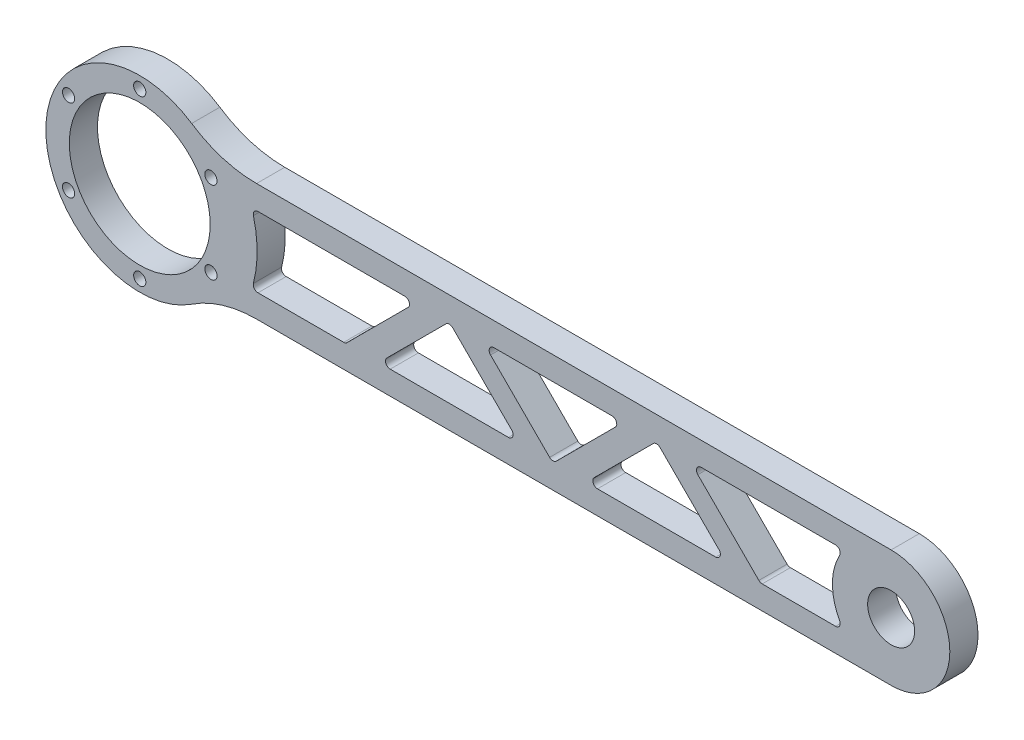
from build123d import *

# Parameters (mm, degrees)
EXTRUDE_1_DEPTH         = 12
SKETCH_5_R              = 30
SKETCH_5_R_2            = 10
CUT_EXTRUDE_1_DEPTH     = 348.51834484
CUT_EXTRUDE_3_DEPTH     = 348.51834484
FILLET_1_R              = 2
HOLE_WIZARD_5_2_5_2_1_D = 5.2


with BuildPart() as part:
    # 草图1 → 凸台-拉伸1 (new body)
    with BuildSketch(Plane.XY):
        with BuildLine():
            Line((320, 25), (49.749371855, 25))
            ThreePointArc((49.749371855, 25), (35.315615126, 27.128644612), (22.110831936, 33.333333333))
            ThreePointArc((22.110831936, 33.333333333), (-40, 0), (22.110831936, -33.333333333))
            ThreePointArc((22.110831936, -33.333333333), (35.315615126, -27.128644612), (49.749371855, -25))
            Line((49.749371855, -25), (320, -25))
            ThreePointArc((320, -25), (345, 0), (320, 25))
        make_face()
    extrude(amount=EXTRUDE_1_DEPTH)

    # 草图5 → 切除-拉伸1 (cut, through all)
    with BuildSketch(Plane.XY.offset(12)):
        Circle(SKETCH_5_R)
        with Locations((320, 0)):
            Circle(SKETCH_5_R_2)
    extrude(amount=-CUT_EXTRUDE_1_DEPTH, mode=Mode.SUBTRACT)

    # 草图6 → 切除-拉伸3 (cut, through all)
    with BuildSketch(Plane.XY.offset(12)):
        with BuildLine():
            Line((47.696960071, 15), (117.696960071, 15))
            Line((117.696960071, 15), (87.696960071, -15))
            Line((87.696960071, -15), (47.696960071, -15))
            ThreePointArc((47.696960071, -15), (50, 0), (47.696960071, 15))
        make_face()
        Polygon((131.839095695, 15), (101.839095695, -15), (161.839095695, -15), align=None)
        Polygon((145.981231318, 15), (175.981231318, -15), (205.981231318, 15), align=None)
        Polygon((220.123366942, 15), (190.123366942, -15), (250.123366942, -15), align=None)
        with BuildLine():
            Line((234.265502566, 15), (264.265502566, -15))
            Line((264.265502566, -15), (300, -15))
            ThreePointArc((300, -15), (295, 0), (300, 15))
            Line((300, 15), (234.265502566, 15))
        make_face()
    extrude(amount=-CUT_EXTRUDE_3_DEPTH, mode=Mode.SUBTRACT)

    # 圆角1
    fillet_1_edges = [part.edges().sort_by_distance(p)[0] for p in [
        (117.696960071, 15, 6),
        (87.696960071, -15, 6),
        (47.696960071, -15, 6),
        (47.696960071, 15, 6),
        (145.981231318, 15, 6),
        (205.981231318, 15, 6),
        (175.981231318, -15, 6),
        (300, 15, 6),
        (300, -15, 6),
        (264.265502566, -15, 6),
        (234.265502566, 15, 6),
        (220.123366942, 15, 6),
        (250.123366942, -15, 6),
        (190.123366942, -15, 6),
        (131.839095695, 15, 6),
        (161.839095695, -15, 6),
        (101.839095695, -15, 6),
    ]]
    fillet(fillet_1_edges, radius=FILLET_1_R)

    # Ø5.2 (5.2) 直径孔1 (through all)
    with Locations(Plane(origin=(0, 35, 12), x_dir=(1, 0, 0), z_dir=(0, 0, 1))):
        with Locations((0, 0), (-30.310889132, -17.5), (-30.310889132, -52.5), (0, -70), (30.310889132, -52.5), (30.310889132, -17.5)):
            Hole(HOLE_WIZARD_5_2_5_2_1_D / 2)


solid = part.part
